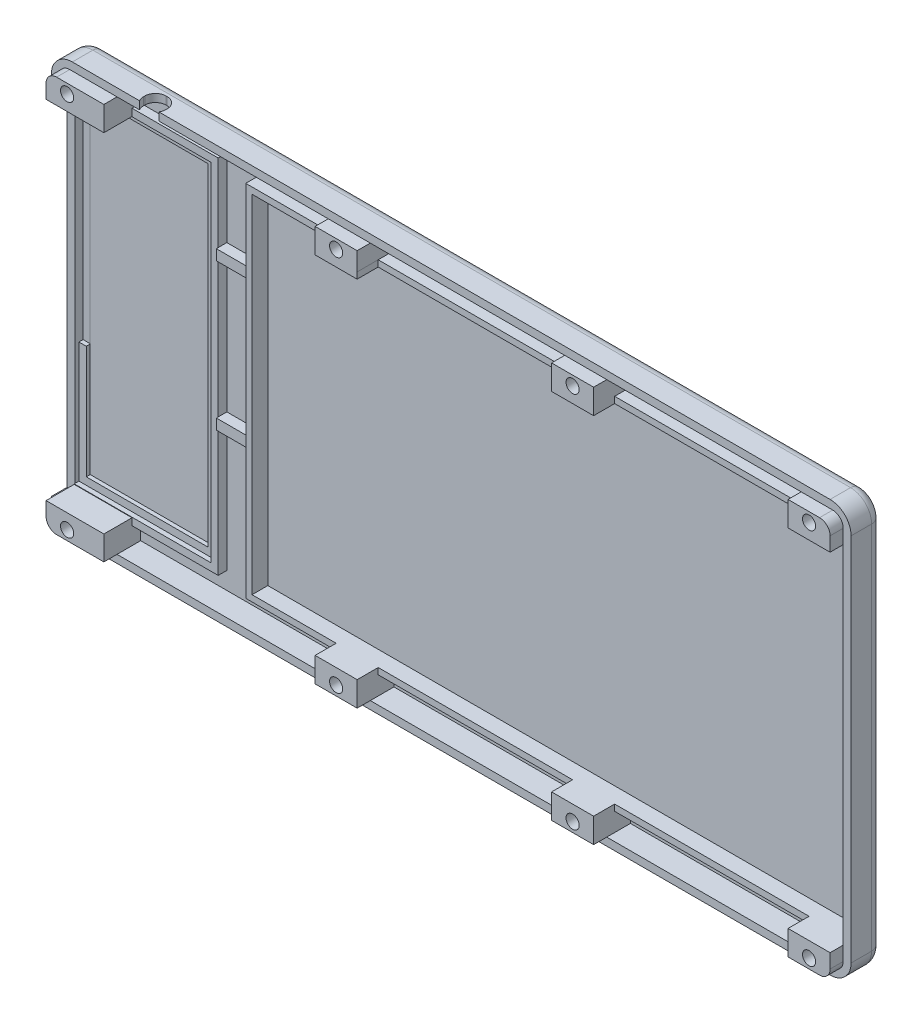
from build123d import *

# Parameters (mm, degrees)
ESQUISSE1_W             = 152.2
ESQUISSE1_H             = 78.4
BOSS_EXTRU_1_DEPTH      = 5.9
BOSS_EXTRU_2_DEPTH      = 1.4
BOSS_EXTRU_5_START      = 1.4
ESQUISSE1_5_R           = 1.25
BOSS_EXTRU_5_DEPTH      = 7
ESQUISSE1_5_W           = 8
ESQUISSE1_5_H           = 3.5
BOSS_EXTRU_5_2_DEPTH    = 7
BOSS_EXTRU_5_3_DEPTH    = 7
BOSS_EXTRU_5_4_DEPTH    = 7
BOSS_EXTRU_5_5_DEPTH    = 7
BOSS_EXTRU_5_6_DEPTH    = 7
BOSS_EXTRU_7_START      = 1.4
BOSS_EXTRU_7_DEPTH      = 3
CONG_1_R                = 4
CONG_4_R                = 2
BOSS_EXTRU_8_START      = 1.4
BOSS_EXTRU_8_DEPTH      = 0.75
BOSS_EXTRU_9_START      = 1.4
BOSS_EXTRU_9_DEPTH      = 1.65
BOSS_EXTRU_11_START     = 7
ESQUISSE4_R             = 1.25
BOSS_EXTRU_11_DEPTH     = 7
ESQUISSE5_W             = 6.6
ESQUISSE5_H             = 2
BOSS_EXTRU_12_DEPTH     = 2
CONG_3_R                = 2
ESQUISSE2_W             = 1.5
ESQUISSE2_H             = 68.8
ENL_V_MAT_EXTRU_1_DEPTH = 3
ENL_V_MAT_EXTRU_2_DEPTH = 1.5
ESQUISSE7_W             = 1.4
ESQUISSE7_H             = 41.680372202
ENL_V_MAT_EXTRU_3_DEPTH = 0.8
ESQUISSE8_W             = 7.99674486
ESQUISSE8_H             = 1.2
ESQUISSE8_W_2           = 8.000773141
ESQUISSE8_W_3           = 8
BOSS_EXTRU_13_DEPTH     = 4


with BuildPart() as part:
    # Esquisse1 → Boss.-Extru.1 (new body)
    with BuildSketch(Plane.XY):
        with Locations((74.6, 37.7)):
            Rectangle(ESQUISSE1_W, ESQUISSE1_H)
        with BuildLine():
            Line((0, 0), (147.2, 0))
            ThreePointArc((147.2, 0), (148.614213562, 0.585786438), (149.2, 2))
            Line((149.2, 2), (149.2, 73.4))
            ThreePointArc((149.2, 73.4), (148.614213562, 74.814213562), (147.2, 75.4))
            Line((147.2, 75.4), (0, 75.4))
            Line((0, 75.4), (0, 0))
        make_face(mode=Mode.SUBTRACT)
    extrude(amount=BOSS_EXTRU_1_DEPTH)

    # Esquisse1<4> → Boss.-Extru.2 (add)
    with BuildSketch(Plane.XY):
        with BuildLine():
            Line((0, 0), (147.2, 0))
            ThreePointArc((147.2, 0), (148.614213562, 0.585786438), (149.2, 2))
            Line((149.2, 2), (149.2, 73.4))
            ThreePointArc((149.2, 73.4), (148.614213562, 74.814213562), (147.2, 75.4))
            Line((147.2, 75.4), (0, 75.4))
            Line((0, 75.4), (0, 0))
        make_face()
    extrude(amount=BOSS_EXTRU_2_DEPTH)

    # Esquisse1<6> → Boss.-Extru.7 (add)
    with BuildSketch(Plane.XY.offset(BOSS_EXTRU_7_START)):
        Polygon((149.2, 70.7), (149.2, 71.9), (141.2, 71.9), (104.2, 71.9), (96.2, 71.9), (59.2, 71.9), (51.2, 71.9), (34, 71.9), (34, 37.7), (35.2, 37.7), (35.2, 70.7), align=None)
        Polygon((149.2, 3.5), (149.2, 4.7), (35.2, 4.7), (35.2, 37.7), (34, 37.7), (34, 3.5), (51.2, 3.5), (59.2, 3.5), (96.2, 3.5), (104.2, 3.5), (141.2, 3.5), align=None)
    extrude(amount=BOSS_EXTRU_7_DEPTH)

    # Congé1
    cong_1_edges = [part.edges().sort_by_distance(p)[0] for p in [
        (-1.5, 76.9, 2.95),
        (150.7, 76.9, 2.95),
        (150.7, -1.5, 2.95),
        (-1.5, -1.5, 2.95),
    ]]
    fillet(cong_1_edges, radius=CONG_1_R)

    # Congé4
    cong_4_edges = [part.edges().sort_by_distance(p)[0] for p in [
        (0, 75.4, 3.65),
        (0, 0, 3.65),
    ]]
    fillet(cong_4_edges, radius=CONG_4_R)

    # Esquisse1<7> → Boss.-Extru.8 (add)
    with BuildSketch(Plane.XY.offset(BOSS_EXTRU_8_START)):
        Polygon((24.6, 37.7), (26, 37.7), (26, 70.7), (0, 70.7), (0, 37.7), (1.4, 37.7), (1.4, 69.3), (24.6, 69.3), align=None)
        Polygon((26, 4.7), (26, 37.7), (24.6, 37.7), (24.6, 6.1), (1.4, 6.1), (1.4, 37.7), (0, 37.7), (0, 4.7), align=None)
    extrude(amount=BOSS_EXTRU_8_DEPTH)

    # Esquisse1<8> → Boss.-Extru.9 (add)
    with BuildSketch(Plane.XY.offset(BOSS_EXTRU_9_START)):
        Polygon((27.4, 3.3), (27.4, 72.1), (0, 72.1), (0, 70.7), (26, 70.7), (26, 4.7), (0, 4.7), (0, 3.3), align=None)
    extrude(amount=BOSS_EXTRU_9_DEPTH)

    # Esquisse4 → Boss.-Extru.11 (add)
    # profile 1 of 2: a face of its own
    with BuildSketch(Plane.XY.offset(1.4).offset(BOSS_EXTRU_11_START)):
        with BuildLine():
            Line((11, 75.4), (2, 75.4))
            ThreePointArc((2, 75.4), (0.585786438, 74.814213562), (0, 73.4))
            Line((0, 73.4), (0, 70.737356087))
            Line((0, 70.737356087), (11, 70.737356087))
            Line((11, 70.737356087), (11, 75.4))
        make_face()
        with Locations((4, 73.6)):
            Circle(ESQUISSE4_R, mode=Mode.SUBTRACT)
    # profile 2 of 2: a face of its own
    with BuildSketch(Plane.XY.offset(1.4).offset(BOSS_EXTRU_11_START)):
        with BuildLine():
            Line((0, 4.608067271), (11, 4.608067271))
            Line((11, 4.608067271), (11, 0))
            Line((11, 0), (2, 0))
            ThreePointArc((2, 0), (0.585786438, 0.585786438), (0, 2))
            Line((0, 2), (0, 4.608067271))
        make_face()
        with Locations((4, 1.8)):
            Circle(ESQUISSE4_R, mode=Mode.SUBTRACT)
    extrude(amount=-BOSS_EXTRU_11_DEPTH)

    # Esquisse5 → Boss.-Extru.12 (add)
    with BuildSketch(Plane.XY.offset(1.4)):
        with Locations((30.7, 56.329620473)):
            Rectangle(ESQUISSE5_W, ESQUISSE5_H)
        with Locations((30.7, 28.421993419)):
            Rectangle(ESQUISSE5_W, ESQUISSE5_H)
    extrude(amount=BOSS_EXTRU_12_DEPTH)

    # Congé3
    cong_3_edges = [part.edges().sort_by_distance(p)[0] for p in [
        (-1.5, 37.7, 0),
        (74.6, 76.9, 0),
        (150.7, 37.7, 0),
        (74.6, -1.5, 0),
        (149.528427125, 75.728427125, 0),
        (149.528427125, -0.328427125, 0),
        (-0.328427125, -0.328427125, 0),
        (-0.328427125, 75.728427125, 0),
    ]]
    fillet(cong_3_edges, radius=CONG_3_R)

    # Esquisse2 → Enlèv. mat.-Extru.1 (cut)
    with BuildSketch(Plane.XY.offset(5.9)):
        with Locations((-0.75, 37.7)):
            Rectangle(ESQUISSE2_W, ESQUISSE2_H)
    extrude(amount=-ENL_V_MAT_EXTRU_1_DEPTH, mode=Mode.SUBTRACT)

    # Esquisse6 → Enlèv. mat.-Extru.2 (cut)
    with BuildSketch(Plane(origin=(0, 76.9, 0), x_dir=(1, 0, 0), z_dir=(0, 1, 0))):
        with BuildLine():
            Line((17, -2.595457244), (17.25, -2.595457244))
            ThreePointArc((17.25, -2.595457244), (18.664213562, -3.181243681), (19.25, -4.595457244))
            Line((19.25, -4.595457244), (19.25, -4.845457244))
            ThreePointArc((19.25, -4.845457244), (18.664213562, -6.259670806), (17.25, -6.845457244))
            Line((17.25, -6.845457244), (17, -6.845457244))
            ThreePointArc((17, -6.845457244), (15.585786438, -6.259670806), (15, -4.845457244))
            Line((15, -4.845457244), (15, -4.595457244))
            ThreePointArc((15, -4.595457244), (15.585786438, -3.181243681), (17, -2.595457244))
        make_face()
    extrude(amount=-ENL_V_MAT_EXTRU_2_DEPTH, mode=Mode.SUBTRACT)

    # Esquisse7 → Enlèv. mat.-Extru.3 (cut)
    with BuildSketch(Plane.XY.offset(2.15)):
        with Locations((0.7, 48.459813899)):
            Rectangle(ESQUISSE7_W, ESQUISSE7_H)
    extrude(amount=-ENL_V_MAT_EXTRU_3_DEPTH, mode=Mode.SUBTRACT)



with BuildPart() as body_2:
    # Esquisse1<5> → Boss.-Extru.5 (new body)
    with BuildSketch(Plane.XY.offset(BOSS_EXTRU_5_START)):
        with BuildLine():
            Line((141.2, 71.9), (149.2, 71.9))
            Line((149.2, 71.9), (149.2, 73.4))
            ThreePointArc((149.2, 73.4), (148.614213562, 74.814213562), (147.2, 75.4))
            Line((147.2, 75.4), (141.2, 75.4))
            Line((141.2, 75.4), (141.2, 71.9))
        make_face()
        with Locations(Location((145.2, 73.6, 0), (0, 0, 180))):
            Circle(ESQUISSE1_5_R, mode=Mode.SUBTRACT)
    extrude(amount=BOSS_EXTRU_5_DEPTH)


with BuildPart() as body_3:
    # Esquisse1<5> → Boss.-Extru.5 2 (new body)
    with BuildSketch(Plane.XY.offset(BOSS_EXTRU_5_START)):
        with Locations((100.2, 73.65)):
            Rectangle(ESQUISSE1_5_W, ESQUISSE1_5_H)
        with Locations(Location((100.2, 73.6, 0), (0, 0, 180))):
            Circle(ESQUISSE1_5_R, mode=Mode.SUBTRACT)
    extrude(amount=BOSS_EXTRU_5_2_DEPTH)


with BuildPart() as body_4:
    # Esquisse1<5> → Boss.-Extru.5 3 (new body)
    with BuildSketch(Plane.XY.offset(BOSS_EXTRU_5_START)):
        with BuildLine():
            Line((149.2, 2), (149.2, 3.5))
            Line((149.2, 3.5), (141.2, 3.5))
            Line((141.2, 3.5), (141.2, 0))
            Line((141.2, 0), (147.2, 0))
            ThreePointArc((147.2, 0), (148.614213562, 0.585786438), (149.2, 2))
        make_face()
        with Locations(Location((145.2, 1.8, 0), (0, 0, 180))):
            Circle(ESQUISSE1_5_R, mode=Mode.SUBTRACT)
    extrude(amount=BOSS_EXTRU_5_3_DEPTH)


with BuildPart() as body_5:
    # Esquisse1<5> → Boss.-Extru.5 4 (new body)
    with BuildSketch(Plane.XY.offset(BOSS_EXTRU_5_START)):
        with Locations((55.2, 73.65)):
            Rectangle(ESQUISSE1_5_W, ESQUISSE1_5_H)
        with Locations(Location((55.2, 73.6, 0), (0, 0, 180))):
            Circle(ESQUISSE1_5_R, mode=Mode.SUBTRACT)
    extrude(amount=BOSS_EXTRU_5_4_DEPTH)


with BuildPart() as body_6:
    # Esquisse1<5> → Boss.-Extru.5 5 (new body)
    with BuildSketch(Plane.XY.offset(BOSS_EXTRU_5_START)):
        with Locations((100.2, 1.75)):
            Rectangle(ESQUISSE1_5_W, ESQUISSE1_5_H)
        with Locations(Location((100.2, 1.8, 0), (0, 0, 180))):
            Circle(ESQUISSE1_5_R, mode=Mode.SUBTRACT)
    extrude(amount=BOSS_EXTRU_5_5_DEPTH)


with BuildPart() as body_7:
    # Esquisse1<5> → Boss.-Extru.5 6 (new body)
    with BuildSketch(Plane.XY.offset(BOSS_EXTRU_5_START)):
        with Locations((55.2, 1.75)):
            Rectangle(ESQUISSE1_5_W, ESQUISSE1_5_H)
        with Locations(Location((55.2, 1.8, 0), (0, 0, 180))):
            Circle(ESQUISSE1_5_R, mode=Mode.SUBTRACT)
    extrude(amount=BOSS_EXTRU_5_6_DEPTH)


with BuildPart() as part_1:
    add(part.part)

    add(body_2.part)  # Boss.-Extru.13 merges body 2

    add(body_3.part)  # Boss.-Extru.13 merges body 3

    add(body_4.part)  # Boss.-Extru.13 merges body 4

    add(body_5.part)  # Boss.-Extru.13 merges body 5

    add(body_6.part)  # Boss.-Extru.13 merges body 6

    add(body_7.part)  # Boss.-Extru.13 merges body 7
    # Esquisse8 → Boss.-Extru.13 (add)
    with BuildSketch(Plane.XY.offset(4.4)):
        with Locations((55.19837243, 71.3)):
            Rectangle(ESQUISSE8_W, ESQUISSE8_H)
        with Locations((100.19961343, 71.3)):
            Rectangle(ESQUISSE8_W_2, ESQUISSE8_H)
        with Locations((145.2, 71.3)):
            Rectangle(ESQUISSE8_W_3, ESQUISSE8_H)
        with Locations((145.2, 4.1)):
            Rectangle(ESQUISSE8_W_3, ESQUISSE8_H)
        with Locations((100.19961343, 4.1)):
            Rectangle(ESQUISSE8_W_2, ESQUISSE8_H)
        with Locations((55.2, 4.1)):
            Rectangle(ESQUISSE8_W_3, ESQUISSE8_H)
    extrude(amount=BOSS_EXTRU_13_DEPTH)


solid = part_1.part
